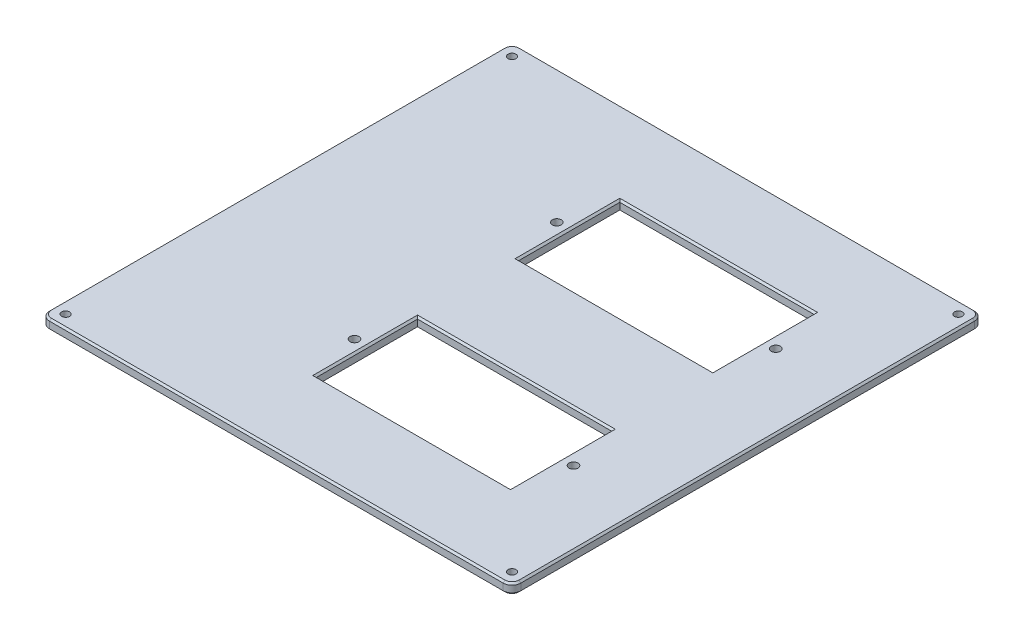
from build123d import *

# Parameters (mm, degrees)
SKETCH1_W           = 268.29
SKETCH1_H           = 268.29
SKETCH1_R           = 2.25
SKETCH1_R_2         = 2.55
SKETCH1_W_2         = 110.6
SKETCH1_H_2         = 57.65
BOSS_EXTRUDE1_DEPTH = 5.8
FILLET1_R           = 5
CHAMFER1_SIZE       = 1


with BuildPart() as part:
    # Sketch1 → Boss-Extrude1 (new body)
    with BuildSketch(Plane(origin=(0, 0, 0), x_dir=(1, 0, 0), z_dir=(0, 1, 0))):
        Rectangle(SKETCH1_W, SKETCH1_H)
        with Locations(Location((-127.095, 127.095, 0), (0, 0, 270))):
            Circle(SKETCH1_R, mode=Mode.SUBTRACT)
        with Locations(Location((127.095, 127.095, 0), (0, 0, 270))):
            Circle(SKETCH1_R, mode=Mode.SUBTRACT)
        with Locations(Location((127.095, -127.095, 0), (0, 0, 270))):
            Circle(SKETCH1_R, mode=Mode.SUBTRACT)
        with Locations(Location((-127.095, -127.095, 0), (0, 0, 270))):
            Circle(SKETCH1_R, mode=Mode.SUBTRACT)
        with Locations(Location((-32.505, 58.02, 0), (0, 0, 270))):
            Circle(SKETCH1_R_2, mode=Mode.SUBTRACT)
        with Locations(Location((-32.505, -57.17, 0), (0, 0, 270))):
            Circle(SKETCH1_R_2, mode=Mode.SUBTRACT)
        with Locations(Location((92.195, -57.17, 0), (0, 0, 270))):
            Circle(SKETCH1_R_2, mode=Mode.SUBTRACT)
        with Locations(Location((92.195, 58.02, 0), (0, 0, 270))):
            Circle(SKETCH1_R_2, mode=Mode.SUBTRACT)
        with Locations((29.845, 58.02)):
            Rectangle(SKETCH1_W_2, SKETCH1_H_2, mode=Mode.SUBTRACT)
        with Locations((29.845, -57.17)):
            Rectangle(SKETCH1_W_2, SKETCH1_H_2, mode=Mode.SUBTRACT)
    extrude(amount=BOSS_EXTRUDE1_DEPTH)

    # Fillet1
    fillet1_edges = [part.edges().sort_by_distance(p)[0] for p in [
        (134.145, 2.9, 134.145),
        (-134.145, 2.9, 134.145),
        (-134.145, 2.9, -134.145),
        (134.145, 2.9, -134.145),
    ]]
    fillet(fillet1_edges, radius=FILLET1_R)

    # Chamfer1
    chamfer1_edges = [part.edges().sort_by_distance(p)[0] for p in [
        (85.145, 0, 57.17),
        (29.845, 0, 28.345),
        (-25.455, 0, 57.17),
        (29.845, 0, 85.995),
        (85.145, 5.8, 57.17),
        (29.845, 5.8, 28.345),
        (-25.455, 5.8, 57.17),
        (29.845, 5.8, 85.995),
        (85.145, 0, -58.02),
        (29.845, 0, -86.845),
        (-25.455, 0, -58.02),
        (29.845, 0, -29.195),
        (85.145, 5.8, -58.02),
        (29.845, 5.8, -86.845),
        (-25.455, 5.8, -58.02),
        (29.845, 5.8, -29.195),
        (134.145, 0, 0),
        (134.145, 5.8, 0),
        (0, 0, 134.145),
        (-134.145, 0, 0),
        (0, 0, -134.145),
        (-132.680533906, 0, 132.680533906),
        (-132.680533906, 0, -132.680533906),
        (132.680533906, 0, -132.680533906),
        (132.680533906, 0, 132.680533906),
        (0, 5.8, 134.145),
        (0, 5.8, -134.145),
        (-134.145, 5.8, 0),
        (-132.680533906, 5.8, 132.680533906),
        (-132.680533906, 5.8, -132.680533906),
        (132.680533906, 5.8, -132.680533906),
        (132.680533906, 5.8, 132.680533906),
    ]]
    chamfer(chamfer1_edges, length=CHAMFER1_SIZE)


solid = part.part
